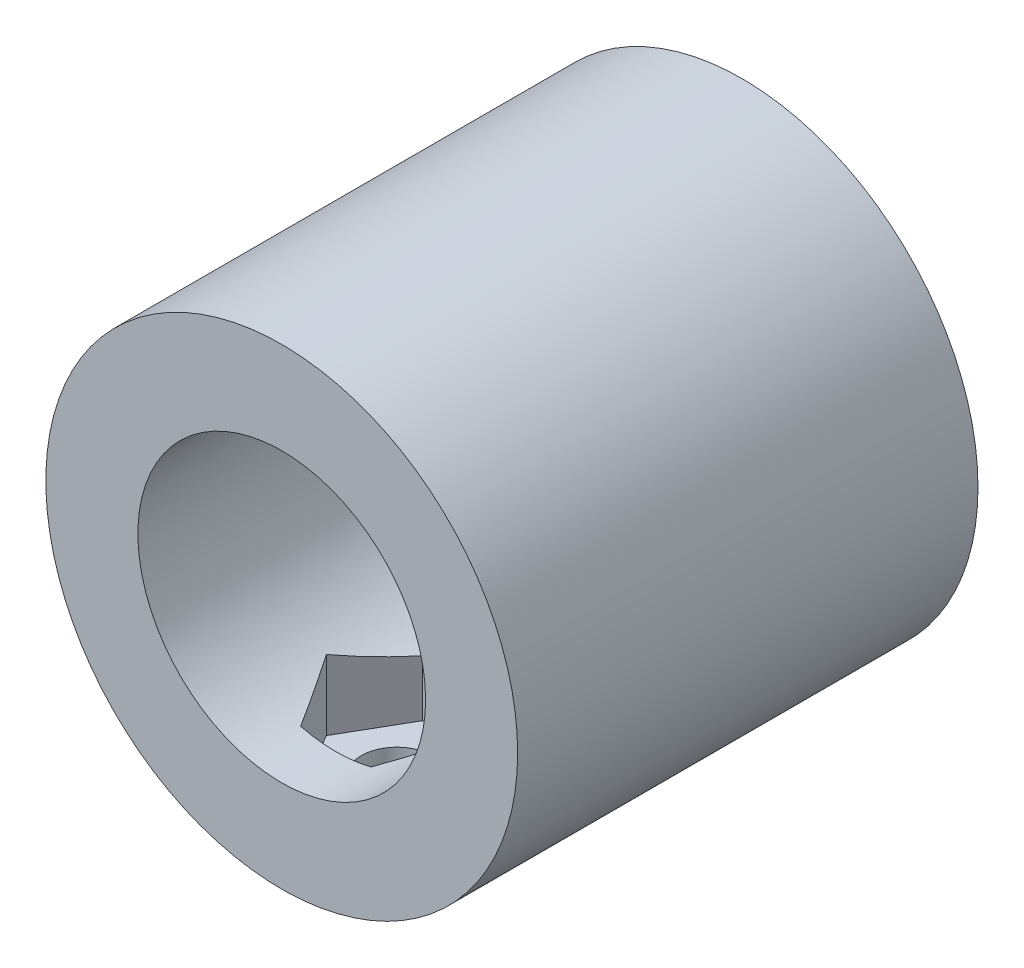
from build123d import *

# Parameters (mm, degrees)
SALIENTE_EXTRUIR1_DEPTH      = 10
SALIENTE_EXTRUIR1_DEPTH_BACK = 10
CROQUIS1_R                   = 10.25
CROQUIS1_R_2                 = 6.25
CROQUIS2_R                   = 1.55
CORTAR_EXTRUIR1_DEPTH        = 8.5
CROQUIS3_R                   = 1.55
CORTAR_EXTRUIR2_DEPTH        = 28.5


with BuildPart() as part:
    # Croquis1 → Saliente-Extruir1 (new, two sides: drawn at the far end of the back side and taken through both)
    with BuildSketch(Plane.XY.offset(-SALIENTE_EXTRUIR1_DEPTH_BACK)):
        Circle(CROQUIS1_R)
        Circle(CROQUIS1_R_2, mode=Mode.SUBTRACT)
    extrude(amount=SALIENTE_EXTRUIR1_DEPTH + SALIENTE_EXTRUIR1_DEPTH_BACK)

    # Croquis2 → Cortar-Extruir1 (cut)
    # profile 1 of 2: a face of its own
    with BuildSketch(Plane(origin=(0, 0, 0), x_dir=(1, 0, 0), z_dir=(0, 1, 0))):
        Polygon((1.529978213, -2.35), (-1.529978213, -2.35), (-3.059956427, -5), (-1.529978213, -7.65), (1.529978213, -7.65), (3.059956427, -5), align=None)
        with Locations((0, -5)):
            Circle(CROQUIS2_R, mode=Mode.SUBTRACT)
    # profile 2 of 2: a face of its own
    with BuildSketch(Plane(origin=(0, 0, 0), x_dir=(1, 0, 0), z_dir=(0, 1, 0))):
        Polygon((3.059956427, 5), (1.529978213, 2.35), (-1.529978213, 2.35), (-3.059956427, 5), (-1.529978213, 7.65), (1.529978213, 7.65), align=None)
        with Locations((0, 5)):
            Circle(CROQUIS2_R, mode=Mode.SUBTRACT)
    extrude(amount=-CORTAR_EXTRUIR1_DEPTH, mode=Mode.SUBTRACT)

    # Croquis3 → Cortar-Extruir2 (cut)
    with BuildSketch(Plane(origin=(0, 0, 0), x_dir=(1, 0, 0), z_dir=(0, 1, 0))):
        with Locations((0, 5)):
            Circle(CROQUIS3_R)
        with Locations((0, -5)):
            Circle(CROQUIS3_R)
    extrude(amount=-CORTAR_EXTRUIR2_DEPTH, mode=Mode.SUBTRACT)


solid = part.part
